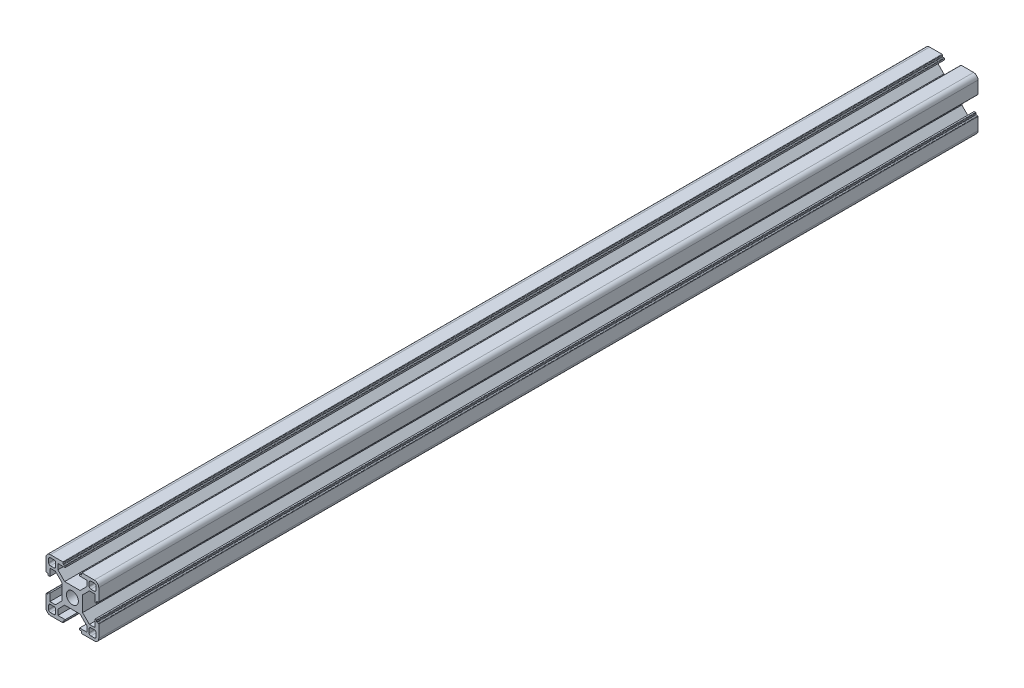
from build123d import *

# Parameters (mm, degrees)
BOSS_EXTRUDE1_DEPTH = 250
SKETCH2_R           = 3.4
CUT_EXTRUDE1_DEPTH  = 251.898385806
FILLET1_R           = 2.5
FILLET2_R           = 0.25
SKETCH3_R           = 3.4
BOSS_EXTRUDE3_DEPTH = 250


with BuildPart() as part:
    # Sketch1 → Boss-Extrude1 (new body)
    with BuildSketch(Plane.XY):
        Polygon((-15, 15), (-5.2, 15), (-5.2, 13.808325472), (-4.1, 13.808325472), (-4.1, 12.8), (-8.25, 12.8), (-8.25, 9.664213562), (-4.385786438, 5.8), (4.385786438, 5.8), (8.25, 9.664213562), (8.25, 12.8), (4.1, 12.8), (4.1, 13.808325472), (5.2, 13.808325472), (5.2, 15), (15, 15), (15, 5.2), (13.808325472, 5.2), (13.808325472, 4.1), (12.8, 4.1), (12.8, 8.25), (9.664213562, 8.25), (5.8, 4.385786438), (5.8, -4.385786438), (9.664213562, -8.25), (12.8, -8.25), (12.8, -4.1), (13.808325472, -4.1), (13.808325472, -5.2), (15, -5.2), (15, -15), (5.2, -15), (5.2, -13.808325472), (4.1, -13.808325472), (4.1, -12.8), (8.25, -12.8), (8.25, -9.664213562), (4.385786438, -5.8), (-4.385786438, -5.8), (-8.25, -9.664213562), (-8.25, -12.8), (-4.1, -12.8), (-4.1, -13.808325472), (-5.2, -13.808325472), (-5.2, -15), (-15, -15), (-15, -5.2), (-13.808325472, -5.2), (-13.808325472, -4.1), (-12.8, -4.1), (-12.8, -8.25), (-9.664213562, -8.25), (-5.8, -4.385786438), (-5.8, 4.385786438), (-9.664213562, 8.25), (-12.8, 8.25), (-12.8, 4.1), (-13.808325472, 4.1), (-13.808325472, 5.2), (-15, 5.2), align=None)
    extrude(amount=BOSS_EXTRUDE1_DEPTH)

    # Sketch2 → Cut-Extrude1 (cut, through all)
    with BuildSketch(Plane.XY.offset(250)):
        Circle(SKETCH2_R)
        with BuildLine():
            Line((-12.5, 13.5), (-10.5, 13.5))
            ThreePointArc((-10.5, 13.5), (-9.792893219, 13.207106781), (-9.5, 12.5))
            Line((-9.5, 12.5), (-9.5, 10.5))
            ThreePointArc((-9.5, 10.5), (-9.792893219, 9.792893219), (-10.5, 9.5))
            Line((-10.5, 9.5), (-12.5, 9.5))
            ThreePointArc((-12.5, 9.5), (-13.207106781, 9.792893219), (-13.5, 10.5))
            Line((-13.5, 10.5), (-13.5, 12.5))
            ThreePointArc((-13.5, 12.5), (-13.207106781, 13.207106781), (-12.5, 13.5))
        make_face()
        with BuildLine():
            Line((9.5, 12.5), (9.5, 10.5))
            ThreePointArc((9.5, 10.5), (9.792893219, 9.792893219), (10.5, 9.5))
            Line((10.5, 9.5), (12.5, 9.5))
            ThreePointArc((12.5, 9.5), (13.207106781, 9.792893219), (13.5, 10.5))
            Line((13.5, 10.5), (13.5, 12.5))
            ThreePointArc((13.5, 12.5), (13.207106781, 13.207106781), (12.5, 13.5))
            Line((12.5, 13.5), (10.5, 13.5))
            ThreePointArc((10.5, 13.5), (9.792893219, 13.207106781), (9.5, 12.5))
        make_face()
        with BuildLine():
            Line((12.5, -13.5), (10.5, -13.5))
            ThreePointArc((10.5, -13.5), (9.792893219, -13.207106781), (9.5, -12.5))
            Line((9.5, -12.5), (9.5, -10.5))
            ThreePointArc((9.5, -10.5), (9.792893219, -9.792893219), (10.5, -9.5))
            Line((10.5, -9.5), (12.5, -9.5))
            ThreePointArc((12.5, -9.5), (13.207106781, -9.792893219), (13.5, -10.5))
            Line((13.5, -10.5), (13.5, -12.5))
            ThreePointArc((13.5, -12.5), (13.207106781, -13.207106781), (12.5, -13.5))
        make_face()
        with BuildLine():
            Line((-9.5, -12.5), (-9.5, -10.5))
            ThreePointArc((-9.5, -10.5), (-9.792893219, -9.792893219), (-10.5, -9.5))
            Line((-10.5, -9.5), (-12.5, -9.5))
            ThreePointArc((-12.5, -9.5), (-13.207106781, -9.792893219), (-13.5, -10.5))
            Line((-13.5, -10.5), (-13.5, -12.5))
            ThreePointArc((-13.5, -12.5), (-13.207106781, -13.207106781), (-12.5, -13.5))
            Line((-12.5, -13.5), (-10.5, -13.5))
            ThreePointArc((-10.5, -13.5), (-9.792893219, -13.207106781), (-9.5, -12.5))
        make_face()
    extrude(amount=-CUT_EXTRUDE1_DEPTH, mode=Mode.SUBTRACT)

    # Fillet1
    fillet1_edges = [part.edges().sort_by_distance(p)[0] for p in [
        (15, -15, 125),
        (-15, -15, 125),
        (-15, 15, 125),
        (15, 15, 125),
    ]]
    fillet(fillet1_edges, radius=FILLET1_R)

    # Fillet2
    fillet2_edges = [part.edges().sort_by_distance(p)[0] for p in [
        (5.2, -15, 125),
        (5.2, -13.808325472, 125),
        (4.1, -13.808325472, 125),
        (-4.1, -13.808325472, 125),
        (-5.2, -13.808325472, 125),
        (-5.2, -15, 125),
        (-15, -5.2, 125),
        (-13.808325472, -5.2, 125),
        (-13.808325472, -4.1, 125),
        (-13.808325472, 4.1, 125),
        (-13.808325472, 5.2, 125),
        (-15, 5.2, 125),
        (-5.2, 15, 125),
        (-5.2, 13.808325472, 125),
        (-4.1, 13.808325472, 125),
        (4.1, 13.808325472, 125),
        (5.2, 13.808325472, 125),
        (5.2, 15, 125),
        (15, 5.2, 125),
        (13.808325472, 5.2, 125),
        (13.808325472, 4.1, 125),
        (13.808325472, -4.1, 125),
        (13.808325472, -5.2, 125),
        (15, -5.2, 125),
    ]]
    fillet(fillet2_edges, radius=FILLET2_R)

    # Sketch3 → Boss-Extrude3 (add)
    with BuildSketch(Plane(origin=(0, 0, 0), x_dir=(-1, 0, 0), z_dir=(0, 0, -1))):
        with BuildLine():
            Line((12.8, 4.1), (13.558325472, 4.1))
            ThreePointArc((13.558325472, 4.1), (13.735102167, 4.173223305), (13.808325472, 4.35))
            Line((13.808325472, 4.35), (13.808325472, 4.95))
            ThreePointArc((13.808325472, 4.95), (13.881548777, 5.126776695), (14.058325472, 5.2))
            Line((14.058325472, 5.2), (14.75, 5.2))
            ThreePointArc((14.75, 5.2), (14.926776695, 5.273223305), (15, 5.45))
            Line((15, 5.45), (15, 12.5))
            ThreePointArc((15, 12.5), (14.267766953, 14.267766953), (12.5, 15))
            Line((12.5, 15), (5.45, 15))
            ThreePointArc((5.45, 15), (5.273223305, 14.926776695), (5.2, 14.75))
            Line((5.2, 14.75), (5.2, 14.058325472))
            ThreePointArc((5.2, 14.058325472), (5.126776695, 13.881548777), (4.95, 13.808325472))
            Line((4.95, 13.808325472), (4.35, 13.808325472))
            ThreePointArc((4.35, 13.808325472), (4.173223305, 13.735102167), (4.1, 13.558325472))
            Line((4.1, 13.558325472), (4.1, 12.8))
            Line((4.1, 12.8), (8.25, 12.8))
            Line((8.25, 12.8), (8.25, 9.664213562))
            Line((8.25, 9.664213562), (4.385786438, 5.8))
            Line((4.385786438, 5.8), (-4.385786438, 5.8))
            Line((-4.385786438, 5.8), (-8.25, 9.664213562))
            Line((-8.25, 9.664213562), (-8.25, 12.8))
            Line((-8.25, 12.8), (-4.1, 12.8))
            Line((-4.1, 12.8), (-4.1, 13.558325472))
            ThreePointArc((-4.1, 13.558325472), (-4.173223305, 13.735102167), (-4.35, 13.808325472))
            Line((-4.35, 13.808325472), (-4.95, 13.808325472))
            ThreePointArc((-4.95, 13.808325472), (-5.126776695, 13.881548777), (-5.2, 14.058325472))
            Line((-5.2, 14.058325472), (-5.2, 14.75))
            ThreePointArc((-5.2, 14.75), (-5.273223305, 14.926776695), (-5.45, 15))
            Line((-5.45, 15), (-12.5, 15))
            ThreePointArc((-12.5, 15), (-14.267766953, 14.267766953), (-15, 12.5))
            Line((-15, 12.5), (-15, 5.45))
            ThreePointArc((-15, 5.45), (-14.926776695, 5.273223305), (-14.75, 5.2))
            Line((-14.75, 5.2), (-14.058325472, 5.2))
            ThreePointArc((-14.058325472, 5.2), (-13.881548777, 5.126776695), (-13.808325472, 4.95))
            Line((-13.808325472, 4.95), (-13.808325472, 4.35))
            ThreePointArc((-13.808325472, 4.35), (-13.735102167, 4.173223305), (-13.558325472, 4.1))
            Line((-13.558325472, 4.1), (-12.8, 4.1))
            Line((-12.8, 4.1), (-12.8, 8.25))
            Line((-12.8, 8.25), (-9.664213562, 8.25))
            Line((-9.664213562, 8.25), (-5.8, 4.385786438))
            Line((-5.8, 4.385786438), (-5.8, -4.385786438))
            Line((-5.8, -4.385786438), (-9.664213562, -8.25))
            Line((-9.664213562, -8.25), (-12.8, -8.25))
            Line((-12.8, -8.25), (-12.8, -4.1))
            Line((-12.8, -4.1), (-13.558325472, -4.1))
            ThreePointArc((-13.558325472, -4.1), (-13.735102167, -4.173223305), (-13.808325472, -4.35))
            Line((-13.808325472, -4.35), (-13.808325472, -4.95))
            ThreePointArc((-13.808325472, -4.95), (-13.881548777, -5.126776695), (-14.058325472, -5.2))
            Line((-14.058325472, -5.2), (-14.75, -5.2))
            ThreePointArc((-14.75, -5.2), (-14.926776695, -5.273223305), (-15, -5.45))
            Line((-15, -5.45), (-15, -12.5))
            ThreePointArc((-15, -12.5), (-14.267766953, -14.267766953), (-12.5, -15))
            Line((-12.5, -15), (-5.45, -15))
            ThreePointArc((-5.45, -15), (-5.273223305, -14.926776695), (-5.2, -14.75))
            Line((-5.2, -14.75), (-5.2, -14.058325472))
            ThreePointArc((-5.2, -14.058325472), (-5.126776695, -13.881548777), (-4.95, -13.808325472))
            Line((-4.95, -13.808325472), (-4.35, -13.808325472))
            ThreePointArc((-4.35, -13.808325472), (-4.173223305, -13.735102167), (-4.1, -13.558325472))
            Line((-4.1, -13.558325472), (-4.1, -12.8))
            Line((-4.1, -12.8), (-8.25, -12.8))
            Line((-8.25, -12.8), (-8.25, -9.664213562))
            Line((-8.25, -9.664213562), (-4.385786438, -5.8))
            Line((-4.385786438, -5.8), (4.385786438, -5.8))
            Line((4.385786438, -5.8), (8.25, -9.664213562))
            Line((8.25, -9.664213562), (8.25, -12.8))
            Line((8.25, -12.8), (4.1, -12.8))
            Line((4.1, -12.8), (4.1, -13.558325472))
            ThreePointArc((4.1, -13.558325472), (4.173223305, -13.735102167), (4.35, -13.808325472))
            Line((4.35, -13.808325472), (4.95, -13.808325472))
            ThreePointArc((4.95, -13.808325472), (5.126776695, -13.881548777), (5.2, -14.058325472))
            Line((5.2, -14.058325472), (5.2, -14.75))
            ThreePointArc((5.2, -14.75), (5.273223305, -14.926776695), (5.45, -15))
            Line((5.45, -15), (12.5, -15))
            ThreePointArc((12.5, -15), (14.267766953, -14.267766953), (15, -12.5))
            Line((15, -12.5), (15, -5.45))
            ThreePointArc((15, -5.45), (14.926776695, -5.273223305), (14.75, -5.2))
            Line((14.75, -5.2), (14.058325472, -5.2))
            ThreePointArc((14.058325472, -5.2), (13.881548777, -5.126776695), (13.808325472, -4.95))
            Line((13.808325472, -4.95), (13.808325472, -4.35))
            ThreePointArc((13.808325472, -4.35), (13.735102167, -4.173223305), (13.558325472, -4.1))
            Line((13.558325472, -4.1), (12.8, -4.1))
            Line((12.8, -4.1), (12.8, -8.25))
            Line((12.8, -8.25), (9.664213562, -8.25))
            Line((9.664213562, -8.25), (5.8, -4.385786438))
            Line((5.8, -4.385786438), (5.8, 4.385786438))
            Line((5.8, 4.385786438), (9.664213562, 8.25))
            Line((9.664213562, 8.25), (12.8, 8.25))
            Line((12.8, 8.25), (12.8, 4.1))
        make_face()
        with Locations(Location((0, 0, 0), (0, 0, 180))):
            Circle(SKETCH3_R, mode=Mode.SUBTRACT)
        with BuildLine():
            Line((-9.5, 12.5), (-9.5, 10.5))
            ThreePointArc((-9.5, 10.5), (-9.792893219, 9.792893219), (-10.5, 9.5))
            Line((-10.5, 9.5), (-12.5, 9.5))
            ThreePointArc((-12.5, 9.5), (-13.207106781, 9.792893219), (-13.5, 10.5))
            Line((-13.5, 10.5), (-13.5, 12.5))
            ThreePointArc((-13.5, 12.5), (-13.207106781, 13.207106781), (-12.5, 13.5))
            Line((-12.5, 13.5), (-10.5, 13.5))
            ThreePointArc((-10.5, 13.5), (-9.792893219, 13.207106781), (-9.5, 12.5))
        make_face(mode=Mode.SUBTRACT)
        with BuildLine():
            Line((12.5, 9.5), (10.5, 9.5))
            ThreePointArc((10.5, 9.5), (9.792893219, 9.792893219), (9.5, 10.5))
            Line((9.5, 10.5), (9.5, 12.5))
            ThreePointArc((9.5, 12.5), (9.792893219, 13.207106781), (10.5, 13.5))
            Line((10.5, 13.5), (12.5, 13.5))
            ThreePointArc((12.5, 13.5), (13.207106781, 13.207106781), (13.5, 12.5))
            Line((13.5, 12.5), (13.5, 10.5))
            ThreePointArc((13.5, 10.5), (13.207106781, 9.792893219), (12.5, 9.5))
        make_face(mode=Mode.SUBTRACT)
        with BuildLine():
            Line((9.5, -12.5), (9.5, -10.5))
            ThreePointArc((9.5, -10.5), (9.792893219, -9.792893219), (10.5, -9.5))
            Line((10.5, -9.5), (12.5, -9.5))
            ThreePointArc((12.5, -9.5), (13.207106781, -9.792893219), (13.5, -10.5))
            Line((13.5, -10.5), (13.5, -12.5))
            ThreePointArc((13.5, -12.5), (13.207106781, -13.207106781), (12.5, -13.5))
            Line((12.5, -13.5), (10.5, -13.5))
            ThreePointArc((10.5, -13.5), (9.792893219, -13.207106781), (9.5, -12.5))
        make_face(mode=Mode.SUBTRACT)
        with BuildLine():
            Line((-9.5, -10.5), (-9.5, -12.5))
            ThreePointArc((-9.5, -12.5), (-9.792893219, -13.207106781), (-10.5, -13.5))
            Line((-10.5, -13.5), (-12.5, -13.5))
            ThreePointArc((-12.5, -13.5), (-13.207106781, -13.207106781), (-13.5, -12.5))
            Line((-13.5, -12.5), (-13.5, -10.5))
            ThreePointArc((-13.5, -10.5), (-13.207106781, -9.792893219), (-12.5, -9.5))
            Line((-12.5, -9.5), (-10.5, -9.5))
            ThreePointArc((-10.5, -9.5), (-9.792893219, -9.792893219), (-9.5, -10.5))
        make_face(mode=Mode.SUBTRACT)
    extrude(amount=BOSS_EXTRUDE3_DEPTH)


solid = part.part
